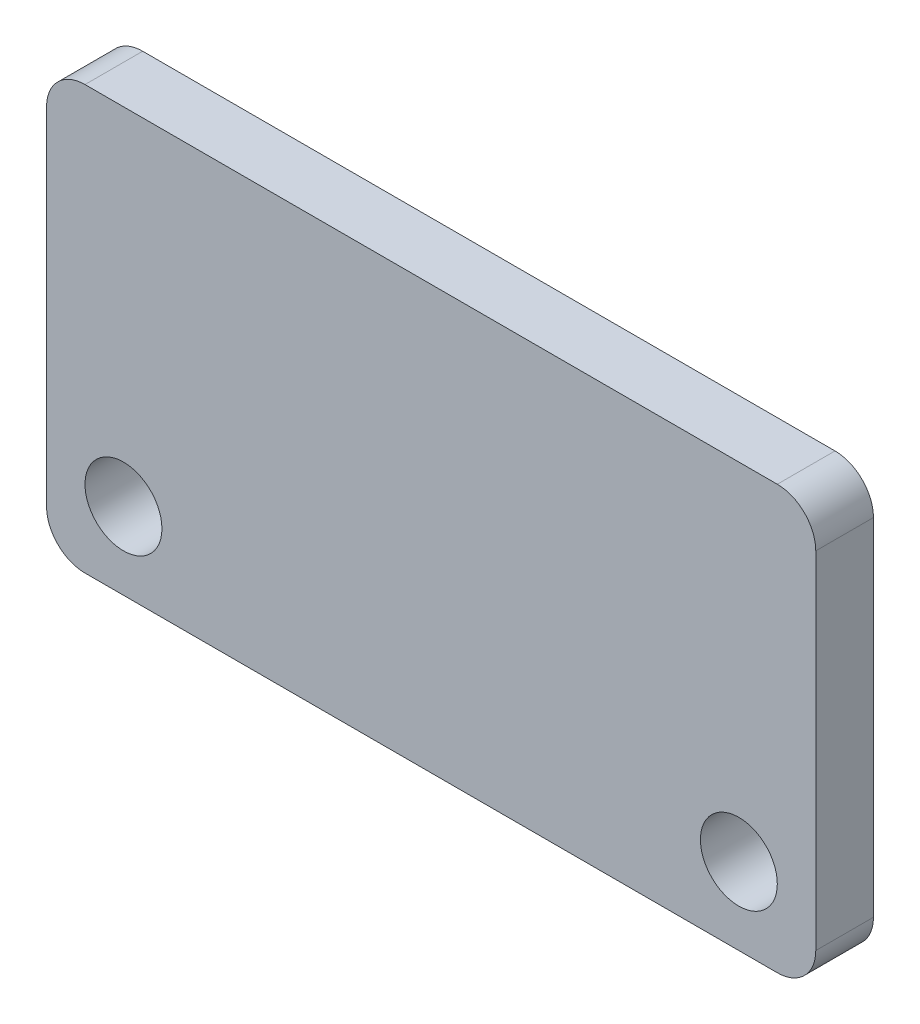
from build123d import *

# Parameters (mm, degrees)
SZKIC1_W                       = 20
SZKIC1_H                       = 11
DODANIE_WYCI_GNI_CIE1_DEPTH    = 1.5
ZAOKR_GLENIE1_R                = 1
OTWORY_USTALAJ_CE_2_0MM1_D     = 2
OTWORY_USTALAJ_CE_2_0MM1_DEPTH = 2
OTWORY_USTALAJ_CE_2_0MM1_TIP   = 0.600860619


with BuildPart() as part:
    # Szkic1 → Dodanie-wyciągnięcie1 (new body)
    with BuildSketch(Plane.XY):
        Rectangle(SZKIC1_W, SZKIC1_H)
    extrude(amount=DODANIE_WYCI_GNI_CIE1_DEPTH)

    # Zaokrąglenie1
    zaokr_glenie1_edges = [part.edges().sort_by_distance(p)[0] for p in [
        (10, -5.5, 0.75),
        (-10, -5.5, 0.75),
        (-10, 5.5, 0.75),
        (10, 5.5, 0.75),
    ]]
    fillet(zaokr_glenie1_edges, radius=ZAOKR_GLENIE1_R)

    # Otwory ustalające Ø2.0mm1
    with Locations(Plane.XY.offset(1.5)):
        with Locations((-8, -3.5), (8, -3.5)):
            Hole(OTWORY_USTALAJ_CE_2_0MM1_D / 2, depth=OTWORY_USTALAJ_CE_2_0MM1_DEPTH)
            with Locations((0, 0, -(OTWORY_USTALAJ_CE_2_0MM1_DEPTH + OTWORY_USTALAJ_CE_2_0MM1_TIP / 2))):  # 118° drill point
                Cone(0, OTWORY_USTALAJ_CE_2_0MM1_D / 2, OTWORY_USTALAJ_CE_2_0MM1_TIP, mode=Mode.SUBTRACT)


solid = part.part
